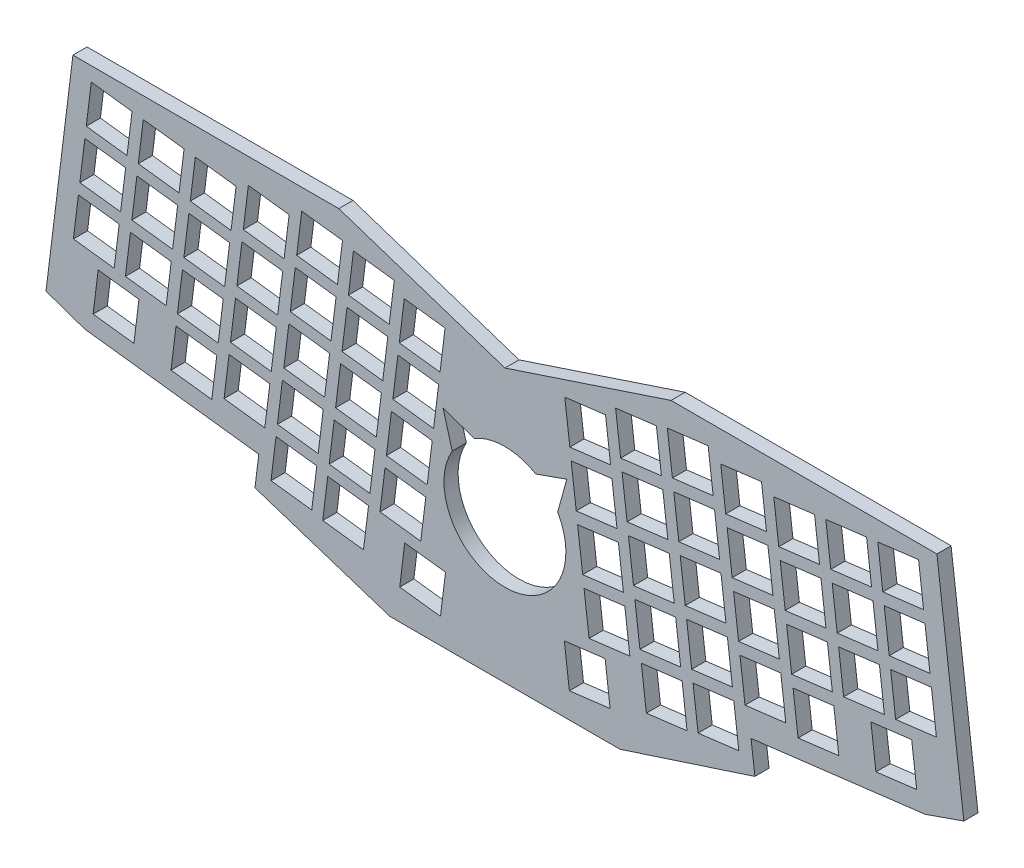
from build123d import *

# Parameters (mm, degrees)
EXTRUDE_2_DEPTH     = 5
CUT_EXTRUDE_5_DEPTH = 173.142382928


with BuildPart() as part:
    # Эскиз4 → Бобышка-Вытянуть2 (new body)
    with BuildSketch(Plane.XY):
        Polygon((152.5, 58), (58.64, 58), (0, 38.59), (-58.64, 58), (-152.5, 58), (-162, -18.92), (-148.354716995, -23.671565122), (-86.885994913, -31.21617284), (-88.237138959, -42.15617284), (-40.597138959, -57.662313559), (40.597138959, -57.662313559), (88.237138959, -42.15617284), (86.885994913, -31.21617284), (148.354716995, -23.671565122), (162, -18.92), align=None)
        with BuildLine():
            Line((21.848195141, 15.513282482), (18.617591482, 3.873282482))
            ThreePointArc((18.617591482, 3.873282482), (0, -28.455), (-18.617591482, 3.873282482))
            Line((-18.617591482, 3.873282482), (-21.848195141, 15.513282482))
            Line((-21.848195141, 15.513282482), (-10.908195141, 11.626317085))
            ThreePointArc((-10.908195141, 11.626317085), (0, 14.595), (10.908195141, 11.626317085))
            Line((10.908195141, 11.626317085), (21.848195141, 15.513282482))
        make_face(mode=Mode.SUBTRACT)
    extrude(amount=EXTRUDE_2_DEPTH)

    # Эскиз6 → Вырез-Вытянуть5 (cut, through all)
    with BuildSketch(Plane.XY.offset(5)):
        Polygon((-148.281572075, 34.639500711), (-150.058889876, 20.248839105), (-135.668228271, 18.471521305), (-133.89091047, 32.86218291), align=None)
        Polygon((-152.326502243, 1.888339816), (-137.935840638, 0.111022015), (-136.158522837, 14.50168362), (-150.549184442, 16.279001421), align=None)
        Polygon((-146.013959708, 53), (-147.791277509, 38.609338395), (-133.400615904, 36.832020594), (-131.623298103, 51.222682199), align=None)
        Polygon((-145.364241994, -17.612094339), (-130.973580389, -19.38941214), (-129.196262588, -4.998750534), (-143.586924193, -3.221432733), align=None)
        Polygon((-132.188685152, 14.011389055), (-117.798023547, 12.234071254), (-119.575341348, -2.156590352), (-133.966002953, -0.379272551), align=None)
        Polygon((-113.262798814, 48.955069832), (-115.040116615, 34.564408227), (-129.43077822, 36.341726028), (-127.653460419, 50.732387633), align=None)
        Polygon((-129.921072786, 32.371888344), (-115.530411181, 30.594570543), (-117.307728981, 16.203908938), (-131.698390587, 17.981226739), align=None)
        Polygon((-109.29296113, 48.464775267), (-111.070278931, 34.074113661), (-96.679617325, 32.29679586), (-94.902299524, 46.687457466), align=None)
        Polygon((-97.169911891, 28.326958176), (-98.947229692, 13.936296571), (-113.337891297, 15.713614372), (-111.560573496, 30.104275977), align=None)
        Polygon((-115.605503664, -2.646884917), (-101.214842059, -4.424202718), (-99.437524258, 9.966458887), (-113.828185863, 11.743776688), align=None)
        Polygon((-117.873116031, -21.007384207), (-103.482454426, -22.784702008), (-101.705136625, -8.394040402), (-116.09579823, -6.616722602), align=None)
        Polygon((-78.446085409, 29.001148721), (-80.22340321, 14.610487116), (-94.614064815, 16.387804917), (-92.836747014, 30.778466522), align=None)
        Polygon((-92.346452449, 34.748304206), (-77.955790843, 32.970986405), (-76.178473042, 47.36164801), (-90.569134648, 49.138965811), align=None)
        Polygon((-97.371971748, -5.942532057), (-99.149289549, -20.333193662), (-84.758627944, -22.110511463), (-82.981310143, -7.719849858), align=None)
        Polygon((-96.881677182, -1.972694373), (-82.491015577, -3.750012174), (-80.713697776, 10.640649432), (-95.104359381, 12.417967233), align=None)
        Polygon((-76.267354063, 13.969481152), (-61.876692458, 12.192163351), (-63.654010259, -2.198498254), (-78.044671864, -0.421180453), align=None)
        Polygon((-78.53496643, -4.391018137), (-64.144304824, -6.168335938), (-65.921622625, -20.558997543), (-80.312284231, -18.781679742), align=None)
        Polygon((-73.999741696, 32.329980442), (-59.609080091, 30.552662641), (-61.386397892, 16.162001036), (-75.777059497, 17.939318837), align=None)
        Polygon((-57.341467724, 48.91316193), (-59.118785525, 34.522500325), (-73.50944713, 36.299818126), (-71.732129329, 50.690479731), align=None)
        Polygon((-80.802578796, -22.751517426), (-66.411917191, -24.528835227), (-68.189234992, -38.919496832), (-82.579896597, -37.142179031), align=None)
        Polygon((-62.537378746, -25.790752682), (-64.314696547, -40.181414287), (-49.924034942, -41.958732088), (-48.146717141, -27.568070483), align=None)
        Polygon((-59.779471813, -3.460415709), (-45.388810208, -5.237733509), (-43.611492407, 9.152928096), (-58.002154012, 10.930245897), align=None)
        Polygon((-60.269766379, -7.430253393), (-62.04708418, -21.820914998), (-47.656422575, -23.598232799), (-45.879104774, -9.207571194), align=None)
        Polygon((-55.24424708, 33.26058287), (-40.853585475, 31.483265069), (-39.076267674, 45.873926674), (-53.466929279, 47.651244475), align=None)
        Polygon((-55.734541646, 29.290745186), (-57.511859447, 14.900083581), (-43.121197841, 13.12276578), (-41.34388004, 27.513427385), align=None)
        Polygon((-25.665210477, 3.531463177), (-27.442528278, -10.859198428), (-41.833189883, -9.081880627), (-40.055872082, 5.308780978), align=None)
        Polygon((-27.932822843, -14.829036113), (-29.710140644, -29.219697718), (-44.10080225, -27.442379917), (-42.323484449, -13.051718312), align=None)
        Polygon((-35.3612242, -32.552152466), (-37.138542001, -46.942814072), (-22.747880395, -48.720131873), (-20.970562594, -34.329470267), align=None)
        Polygon((-23.39759811, 21.891962466), (-25.174915911, 7.501300861), (-39.565577516, 9.278618662), (-37.788259715, 23.669280267), align=None)
        Polygon((-37.297965149, 27.639117951), (-22.907303544, 25.86180015), (-21.129985743, 40.252461755), (-35.520647348, 42.029779556), align=None)
        Polygon((35.520647348, 42.029779556), (21.129985743, 40.252461755), (22.907303544, 25.86180015), (37.297965149, 27.639117951), align=None)
        Polygon((37.138542001, -46.942814072), (22.747880395, -48.720131873), (20.970562594, -34.329470267), (35.3612242, -32.552152466), align=None)
        Polygon((37.788259715, 23.669280267), (39.565577516, 9.278618662), (25.174915911, 7.501300861), (23.39759811, 21.891962466), align=None)
        Polygon((42.323484449, -13.051718312), (44.10080225, -27.442379917), (29.710140644, -29.219697718), (27.932822843, -14.829036113), align=None)
        Polygon((40.055872082, 5.308780978), (41.833189883, -9.081880627), (27.442528278, -10.859198428), (25.665210477, 3.531463177), align=None)
        Polygon((53.466929279, 47.651244475), (39.076267674, 45.873926674), (40.853585475, 31.483265069), (55.24424708, 33.26058287), align=None)
        Polygon((64.314696547, -40.181414287), (49.924034942, -41.958732088), (48.146717141, -27.568070483), (62.537378746, -25.790752682), align=None)
        Polygon((55.734541646, 29.290745186), (41.34388004, 27.513427385), (43.121197841, 13.12276578), (57.511859447, 14.900083581), align=None)
        Polygon((58.002154012, 10.930245897), (59.779471813, -3.460415709), (45.388810208, -5.237733509), (43.611492407, 9.152928096), align=None)
        Polygon((62.04708418, -21.820914998), (47.656422575, -23.598232799), (45.879104774, -9.207571194), (60.269766379, -7.430253393), align=None)
        Polygon((66.411917191, -24.528835227), (68.189234992, -38.919496832), (82.579896597, -37.142179031), (80.802578796, -22.751517426), align=None)
        Polygon((61.876692458, 12.192163351), (63.654010259, -2.198498254), (78.044671864, -0.421180453), (76.267354063, 13.969481152), align=None)
        Polygon((73.50944713, 36.299818126), (59.118785525, 34.522500325), (57.341467724, 48.91316193), (71.732129329, 50.690479731), align=None)
        Polygon((75.777059497, 17.939318837), (61.386397892, 16.162001036), (59.609080091, 30.552662641), (73.999741696, 32.329980442), align=None)
        Polygon((80.312284231, -18.781679742), (65.921622625, -20.558997543), (64.144304824, -6.168335938), (78.53496643, -4.391018137), align=None)
        Polygon((92.836747014, 30.778466522), (94.614064815, 16.387804917), (80.22340321, 14.610487116), (78.446085409, 29.001148721), align=None)
        Polygon((90.569134648, 49.138965811), (92.346452449, 34.748304206), (77.955790843, 32.970986405), (76.178473042, 47.36164801), align=None)
        Polygon((95.104359381, 12.417967233), (96.881677182, -1.972694373), (82.491015577, -3.750012174), (80.713697776, 10.640649432), align=None)
        Polygon((99.149289549, -20.333193662), (84.758627944, -22.110511463), (82.981310143, -7.719849858), (97.371971748, -5.942532057), align=None)
        Polygon((116.09579823, -6.616722602), (101.705136625, -8.394040402), (103.482454426, -22.784702008), (117.873116031, -21.007384207), align=None)
        Polygon((111.560573496, 30.104275977), (113.337891297, 15.713614372), (98.947229692, 13.936296571), (97.169911891, 28.326958176), align=None)
        Polygon((111.070278931, 34.074113661), (96.679617325, 32.29679586), (94.902299524, 46.687457466), (109.29296113, 48.464775267), align=None)
        Polygon((113.828185863, 11.743776688), (115.605503664, -2.646884917), (101.214842059, -4.424202718), (99.437524258, 9.966458887), align=None)
        Polygon((131.698390587, 17.981226739), (117.307728981, 16.203908938), (115.530411181, 30.594570543), (129.921072786, 32.371888344), align=None)
        Polygon((132.188685152, 14.011389055), (133.966002953, -0.379272551), (119.575341348, -2.156590352), (117.798023547, 12.234071254), align=None)
        Polygon((127.653460419, 50.732387633), (129.43077822, 36.341726028), (115.040116615, 34.564408227), (113.262798814, 48.955069832), align=None)
        Polygon((143.586924193, -3.221432733), (145.364241994, -17.612094339), (130.973580389, -19.38941214), (129.196262588, -4.998750534), align=None)
        Polygon((150.549184442, 16.279001421), (136.158522837, 14.50168362), (137.935840638, 0.111022015), (152.326502243, 1.888339816), align=None)
        Polygon((131.623298103, 51.222682199), (133.400615904, 36.832020594), (147.791277509, 38.609338395), (146.013959708, 53), align=None)
        Polygon((133.89091047, 32.86218291), (135.668228271, 18.471521305), (150.058889876, 20.248839105), (148.281572075, 34.639500711), align=None)
    extrude(amount=-CUT_EXTRUDE_5_DEPTH, mode=Mode.SUBTRACT)


solid = part.part
